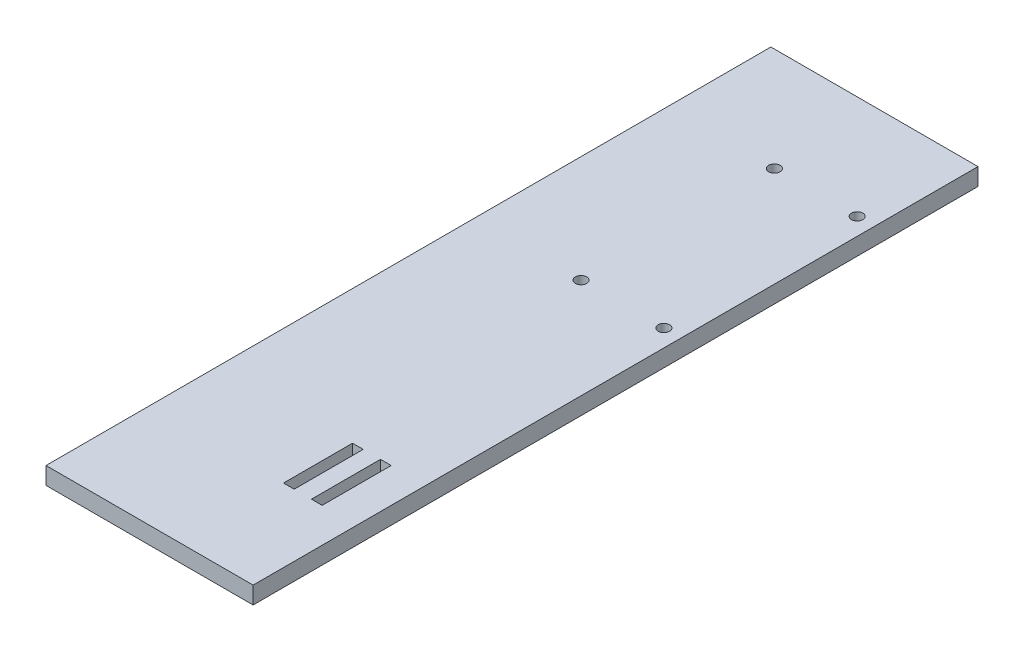
from build123d import *

# Parameters (mm, degrees)
SKETCH1_W           = 60
SKETCH1_H           = 210
BOSS_EXTRUDE1_DEPTH = 5
SKETCH2_W           = 3.1
SKETCH2_H           = 20
CUT_EXTRUDE1_DEPTH  = 5
SKETCH3_R           = 1.65
CUT_EXTRUDE2_DEPTH  = 5


with BuildPart() as part:
    # Sketch1 → Boss-Extrude1 (new body)
    with BuildSketch(Plane(origin=(0, 0, 0), x_dir=(1, 0, 0), z_dir=(0, 1, 0))):
        with Locations((30, 105)):
            Rectangle(SKETCH1_W, SKETCH1_H)
    extrude(amount=BOSS_EXTRUDE1_DEPTH)

    # Sketch2 → Cut-Extrude1 (cut)
    with BuildSketch(Plane(origin=(0, 5, 0), x_dir=(1, 0, 0), z_dir=(0, 1, 0))):
        with Locations((48.45, 40)):
            Rectangle(SKETCH2_W, SKETCH2_H)
        with Locations((40.35, 40)):
            Rectangle(SKETCH2_W, SKETCH2_H)
    extrude(amount=-CUT_EXTRUDE1_DEPTH, mode=Mode.SUBTRACT)

    # Sketch3 → Cut-Extrude2 (cut)
    with BuildSketch(Plane(origin=(0, 5, 0), x_dir=(1, 0, 0), z_dir=(0, 1, 0))):
        with Locations(Location((55, 180, 0), (0, 0, 270))):
            Circle(SKETCH3_R)
        with Locations(Location((55, 124, 0), (0, 0, 90))):
            Circle(SKETCH3_R)
        with Locations(Location((31, 124, 0), (0, 0, 270))):
            Circle(SKETCH3_R)
        with Locations(Location((31, 180, 0), (0, 0, 90))):
            Circle(SKETCH3_R)
    extrude(amount=-CUT_EXTRUDE2_DEPTH, mode=Mode.SUBTRACT)


solid = part.part
